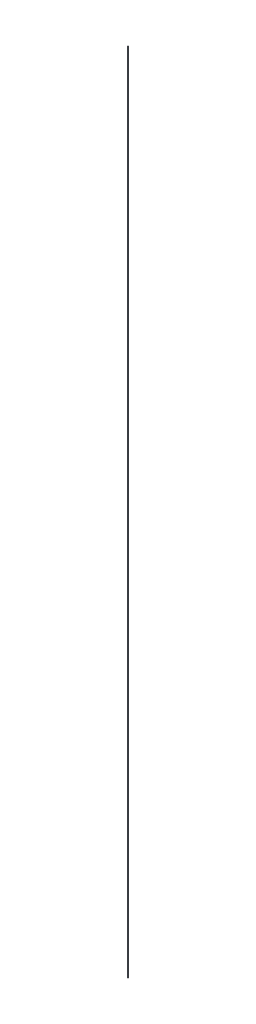
from build123d import *

# Parameters (mm, degrees)
SKETCH1_R           = 1.5
BOSS_EXTRUDE1_DEPTH = 3000


with BuildPart() as part:
    # Sketch1 → Boss-Extrude1 (new body)
    with BuildSketch(Plane(origin=(0, 0, 0), x_dir=(1, 0, 0), z_dir=(0, 1, 0))):
        with Locations(Location((0, 0, 0), (0, 0, 270))):
            Circle(SKETCH1_R)
    extrude(amount=BOSS_EXTRUDE1_DEPTH)


solid = part.part
